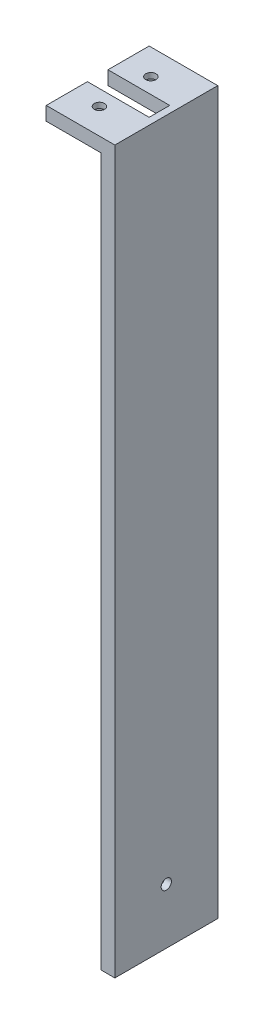
from build123d import *

# Parameters (mm, degrees)
EXTRU_MINCE1_DEPTH      = 38.1
ESQUISSE2_R             = 1.89865
ENL_V_MAT_EXTRU_1_DEPTH = 228.663979486
ENL_V_MAT_EXTRU_2_DEPTH = 3.048
D_GAGEMENT_61_D         = 3.7973
ESQUISSE6_W             = 7.62
ESQUISSE6_H             = 267.100210441
ENL_V_MAT_EXTRU_3_DEPTH = 22.86


with BuildPart() as part:
    # Esquisse1 → Extru.-Mince1 (new body)
    with BuildSketch(Plane.XY):
        Polygon((90.805, 44.088736397), (116.205, 44.088736397), (116.205, -223.011474044), (111.125, -223.011474044), (111.125, 39.008736397), (90.805, 39.008736397), align=None)
    extrude(amount=-EXTRU_MINCE1_DEPTH)

    # Esquisse2 → Enlèv. mat.-Extru.1 (cut, through all)
    with BuildSketch(Plane(origin=(116.205, 0, 0), x_dir=(0, 0, -1), z_dir=(1, 0, 0))):
        with Locations(Location((19.05, -202.469224044, 0), (0, 0, 90))):
            Circle(ESQUISSE2_R)
    extrude(amount=-ENL_V_MAT_EXTRU_1_DEPTH, mode=Mode.SUBTRACT)

    # Esquisse3 → Enlèv. mat.-Extru.2 (cut)
    with BuildSketch(Plane.XZ.offset(-39.008736397)):
        Polygon((100.965, -23.735650044), (96.774, -26.155325022), (96.774, -30.994674978), (100.965, -33.414349956), (105.156, -30.994674978), (105.156, -26.155325022), align=None)
        Polygon((100.965, -4.685650044), (96.774, -7.105325022), (96.774, -11.944674978), (100.965, -14.364349956), (105.156, -11.944674978), (105.156, -7.105325022), align=None)
    extrude(amount=-ENL_V_MAT_EXTRU_2_DEPTH, mode=Mode.SUBTRACT)

    # Dégagement #61 (through all)
    with Locations(Plane(origin=(0, 42.056736397, 0), x_dir=(-1, 0, 0), z_dir=(0, -1, 0))):
        with Locations((-100.965, 28.575), (-100.965, 9.525)):
            Hole(D_GAGEMENT_61_D / 2)

    # Esquisse6 → Enlèv. mat.-Extru.3 (cut)
    with BuildSketch(Plane.ZY.offset(-90.805)):
        with Locations((-19.05, -89.461368824)):
            Rectangle(ESQUISSE6_W, ESQUISSE6_H)
    extrude(amount=-ENL_V_MAT_EXTRU_3_DEPTH, mode=Mode.SUBTRACT)


solid = part.part
